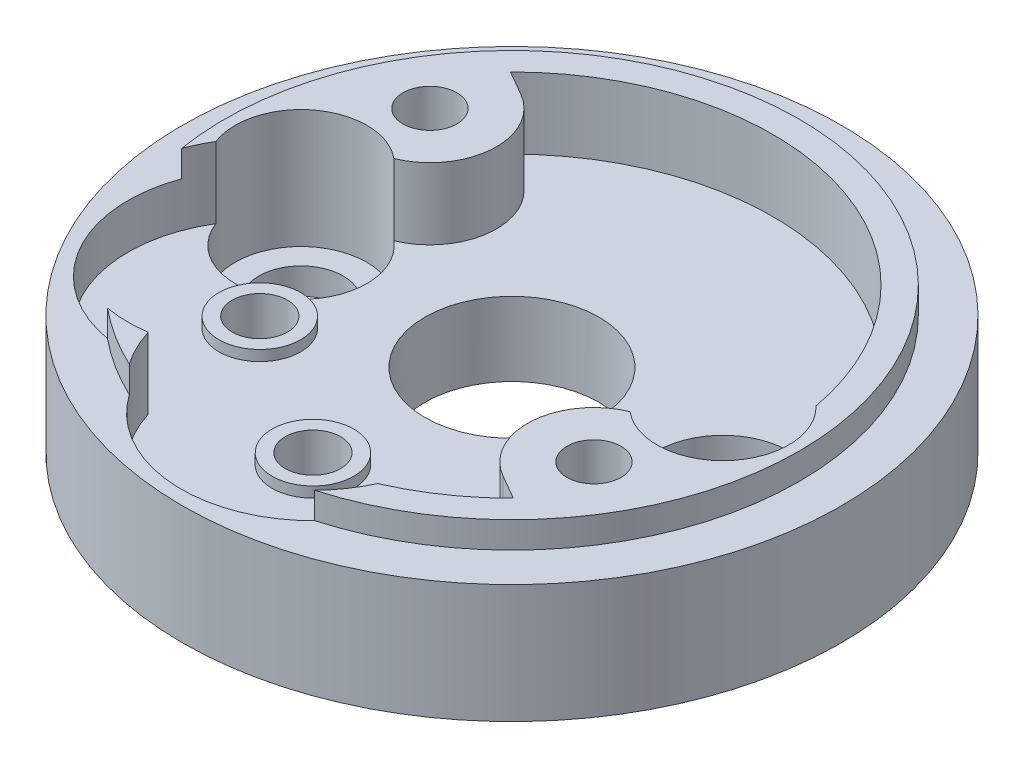
from build123d import *
from build123d.topology import SkipClean

# Parameters (mm, degrees)
SKETCH1_R           = 12.5
BOSS_EXTRUDE1_DEPTH = 5.5
SKETCH2_OUTSIDE_W   = 34.156
SKETCH2_OUTSIDE_H   = 34.156
SKETCH2_OUTSIDE_R   = 10.9
CUT_EXTRUDE1_DEPTH  = 1
SKETCH3_R           = 9.9
CUT_EXTRUDE2_DEPTH  = 2.7
SKETCH4_R           = 3.3
SKETCH4_R_2         = 1.6
CUT_EXTRUDE3_DEPTH  = 19.513508582
CUT_EXTRUDE4_START  = -1
SKETCH5_R           = 2.5
CUT_EXTRUDE4_DEPTH  = 18.513508582
SKETCH6_R           = 1.025
CUT_EXTRUDE5_DEPTH  = 19.513508582
SKETCH7_R           = 1.025
BOSS_EXTRUDE2_DEPTH = 2.7
BOSS_EXTRUDE3_START = 2.7
BOSS_EXTRUDE3_DEPTH = 2.7
CIRPATTERN1_COUNT   = 2
SKETCH9_R           = 1.05
CUT_EXTRUDE6_DEPTH  = 18.898044586
BOSS_EXTRUDE4_START = 0.4
SKETCH10_R          = 1.55
SKETCH10_R_2        = 1.05
BOSS_EXTRUDE4_DEPTH = 0.4
SKETCH11_R          = 1.55
CUT_EXTRUDE7_DEPTH  = 18.898044586


with BuildPart() as part:
    # Sketch1 → Boss-Extrude1 (new body)
    with BuildSketch(Plane(origin=(0, 0, 0), x_dir=(1, 0, 0), z_dir=(0, 1, 0))):
        with Locations(Location((0, 0, 0), (0, 0, 270))):
            Circle(SKETCH1_R)
    extrude(amount=BOSS_EXTRUDE1_DEPTH)

    # Sketch2 outside → Cut-Extrude1 (cut)
    with BuildSketch(Plane(origin=(0, 5.5, 0), x_dir=(1, 0, 0), z_dir=(0, 1, 0))):
        Rectangle(SKETCH2_OUTSIDE_W, SKETCH2_OUTSIDE_H)
        with Locations(Location((0, 0, 0), (0, 0, 270))):
            Circle(SKETCH2_OUTSIDE_R, mode=Mode.SUBTRACT)
    extrude(amount=-CUT_EXTRUDE1_DEPTH, mode=Mode.SUBTRACT)

    # Sketch3 → Cut-Extrude2 (cut)
    with BuildSketch(Plane(origin=(0, 5.5, 0), x_dir=(1, 0, 0), z_dir=(0, 1, 0))):
        with Locations(Location((0, 0, 0), (0, 0, 270))):
            Circle(SKETCH3_R)
    extrude(amount=-CUT_EXTRUDE2_DEPTH, mode=Mode.SUBTRACT)

    # Sketch4 → Cut-Extrude3 (cut, through all)
    with BuildSketch(Plane.XZ):
        with Locations(Location((0, 0, 0), (0, 0, 270))):
            Circle(SKETCH4_R)
        with Locations(Location((8, 0, 0), (0, 0, 270))):
            Circle(SKETCH4_R_2)
        with Locations(Location((-8, 0, 0), (0, 0, 270))):
            Circle(SKETCH4_R_2)
    extrude(amount=-CUT_EXTRUDE3_DEPTH, mode=Mode.SUBTRACT)

    # Sketch5 → Cut-Extrude4 (cut, through all)
    with BuildSketch(Plane.XZ.offset(CUT_EXTRUDE4_START)):
        with Locations(Location((-8, 0, 0), (0, 0, 270))):
            Circle(SKETCH5_R)
        with Locations(Location((8, 0, 0), (0, 0, 270))):
            Circle(SKETCH5_R)
    extrude(amount=-CUT_EXTRUDE4_DEPTH, mode=Mode.SUBTRACT)

    # Sketch6 → Cut-Extrude5 (cut, through all)
    with BuildSketch(Plane.XZ):
        with Locations(Location((-7.361215932, -4.25, 0), (0, 0, 270))):
            Circle(SKETCH6_R)
        with Locations(Location((7.361215932, 4.25, 0), (0, 0, 270))):
            Circle(SKETCH6_R)
    extrude(amount=-CUT_EXTRUDE5_DEPTH, mode=Mode.SUBTRACT)

    # Sketch7 → Boss-Extrude2 (add)
    with BuildSketch(Plane(origin=(0, 2.8, 0), x_dir=(1, 0, 0), z_dir=(0, 1, 0))):
        with BuildLine():
            Line((-7.027601402, 6.97300642), (-6.098715932, 6.436714145))
            ThreePointArc((-6.098715932, 6.436714145), (-4.841636094, 4.084644513), (-6.39533393, 1.917041158))
            ThreePointArc((-6.39533393, 1.917041158), (-7.650163067, 2.47540181), (-9.010579303, 2.286641527))
            Line((-9.010579303, 2.286641527), (-9.552601402, 2.599578131))
            ThreePointArc((-9.552601402, 2.599578131), (-8.573651497, 4.95), (-7.027601402, 6.97300642))
        make_face()
        with Locations(Location((-7.361215932, 4.25, 0), (0, 0, 90))):
            Circle(SKETCH7_R, mode=Mode.SUBTRACT)
    boss_extrude2 = extrude(amount=BOSS_EXTRUDE2_DEPTH)

    # Sketch8 → Boss-Extrude3 (add)
    with BuildSketch(Plane(origin=(0, 2.8, 0), x_dir=(1, 0, 0), z_dir=(0, 1, 0)).offset(BOSS_EXTRUDE3_START)):
        with BuildLine():
            Line((-9.010579303, 2.286641527), (-9.552601402, 2.599578131))
            ThreePointArc((-9.552601402, 2.599578131), (-9.652085176, 2.20164751), (-9.735, 1.799937499))
            ThreePointArc((-9.735, 1.799937499), (-9.394192107, 2.075145385), (-9.010579303, 2.286641527))
        make_face()
    boss_extrude3 = extrude(amount=-BOSS_EXTRUDE3_DEPTH)

    # CirPattern1: Boss-Extrude2, Boss-Extrude3 ×2 about axis
    with SkipClean():  # the faces are left unmerged after this step: merging them gives an invalid solid
        cirpattern1_axis = Axis((0, 0, 0), (0, 1, 0))
        add([boss_extrude2.rotate(cirpattern1_axis, i * 360 / CIRPATTERN1_COUNT) for i in range(1, CIRPATTERN1_COUNT)])
        add([boss_extrude3.rotate(cirpattern1_axis, i * 360 / CIRPATTERN1_COUNT) for i in range(1, CIRPATTERN1_COUNT)])

    # Sketch9 → Cut-Extrude6 (cut, through all)
    with SkipClean():  # the faces are left unmerged after this step: merging them gives an invalid solid
        with BuildSketch(Plane(origin=(0, 2.8, 0), x_dir=(1, 0, 0), z_dir=(0, 1, 0))):
            with Locations(Location((-6.062177826, -3.5, 0), (0, 0, 270))):
                Circle(SKETCH9_R)
            with Locations(Location((-0.570159055, -6.976741263, 0), (0, 0, 270))):
                Circle(SKETCH9_R)
        extrude(amount=-CUT_EXTRUDE6_DEPTH, mode=Mode.SUBTRACT)

    # Sketch10 → Boss-Extrude4 (add)
    # profile 1 of 2: a face of its own
    with SkipClean():  # the faces are left unmerged after this step: merging them gives an invalid solid
        with BuildSketch(Plane(origin=(0, 2.8, 0), x_dir=(1, 0, 0), z_dir=(0, 1, 0)).offset(BOSS_EXTRUDE4_START)):
            with Locations(Location((-6.062177826, -3.5, 0), (0, 0, 107.579513766))):
                Circle(SKETCH10_R)
            with Locations(Location((-6.062177826, -3.5, 0), (0, 0, 270))):
                Circle(SKETCH10_R_2, mode=Mode.SUBTRACT)
        # profile 2 of 2: a face of its own
        with BuildSketch(Plane(origin=(0, 2.8, 0), x_dir=(1, 0, 0), z_dir=(0, 1, 0)).offset(BOSS_EXTRUDE4_START)):
            with Locations(Location((-0.570159055, -6.976741263, 0), (0, 0, 270))):
                Circle(SKETCH10_R)
            with Locations(Location((-0.570159055, -6.976741263, 0), (0, 0, 270))):
                Circle(SKETCH10_R_2, mode=Mode.SUBTRACT)
        extrude(amount=-BOSS_EXTRUDE4_DEPTH)

    # Sketch11 → Cut-Extrude7 (cut, through all)
    with SkipClean():  # the faces are left unmerged after this step: merging them gives an invalid solid
        with BuildSketch(Plane(origin=(0, 2.8, 0), x_dir=(1, 0, 0), z_dir=(0, 1, 0))):
            with BuildLine():
                ThreePointArc((-1.283787966, -2.027929913), (-10.286807651, -0.825583644), (-5.348548915, -8.44881135))
                ThreePointArc((-5.348548915, -8.44881135), (3.65447077, -9.651157619), (-1.283787966, -2.027929913))
            make_face()
            with Locations(Location((-6.062177826, -3.5, 0), (0, 0, 107.579513766))):
                Circle(SKETCH11_R, mode=Mode.SUBTRACT)
            with Locations(Location((-0.570159055, -6.976741263, 0), (0, 0, 270))):
                Circle(SKETCH11_R, mode=Mode.SUBTRACT)
        extrude(amount=CUT_EXTRUDE7_DEPTH, mode=Mode.SUBTRACT)


solid = part.part
